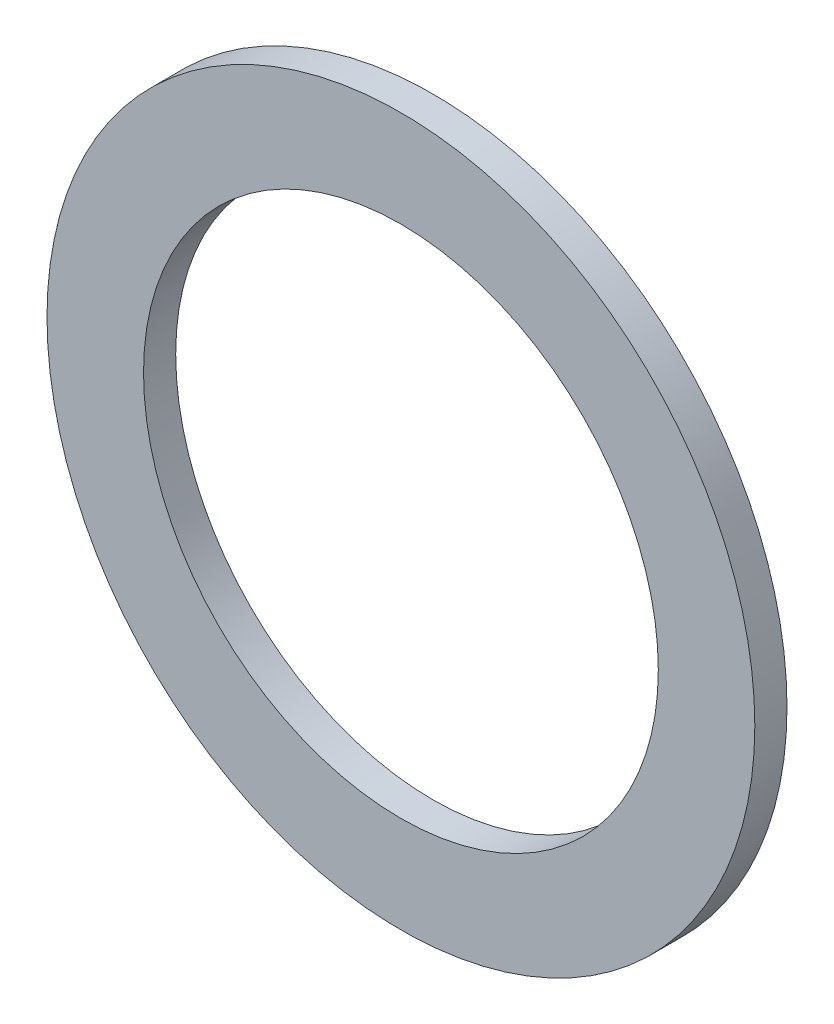
from build123d import *

# Parameters (mm, degrees)
SKETCH1_R           = 2.75
SKETCH1_R_2         = 2
BOSS_EXTRUDE1_DEPTH = 0.25


with BuildPart() as part:
    # Sketch1 → Boss-Extrude1 (new body)
    with BuildSketch(Plane.XY):
        Circle(SKETCH1_R)
        Circle(SKETCH1_R_2, mode=Mode.SUBTRACT)
    extrude(amount=BOSS_EXTRUDE1_DEPTH)


solid = part.part
